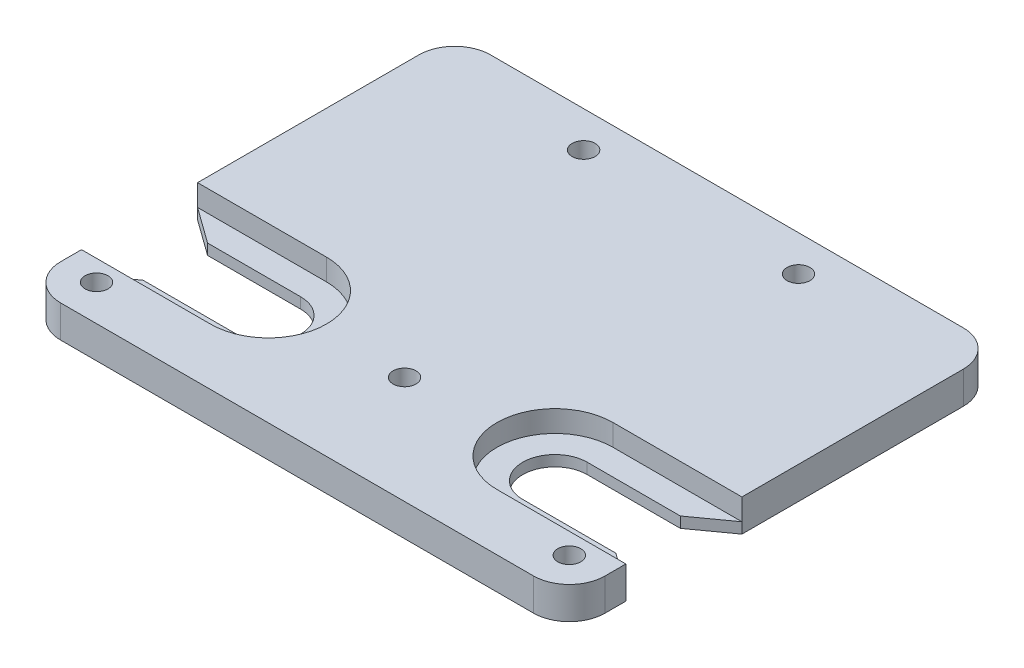
from build123d import *

# Parameters (mm, degrees)
SKETCH1_W           = 76
SKETCH1_H           = 60
BOSS_EXTRUDE1_DEPTH = 4.5
CUT_EXTRUDE1_DEPTH  = 3
CUT_EXTRUDE2_DEPTH  = 49.507731343
FILLET1_R           = 5
SKETCH4_R           = 1.6
CUT_EXTRUDE3_DEPTH  = 49.623553963


with BuildPart() as part:
    # Sketch1 → Boss-Extrude1 (new body)
    with BuildSketch(Plane(origin=(0, 0, 0), x_dir=(1, 0, 0), z_dir=(0, 1, 0))):
        Rectangle(SKETCH1_W, SKETCH1_H)
    extrude(amount=BOSS_EXTRUDE1_DEPTH)

    # Sketch2 → Cut-Extrude1 (cut)
    with BuildSketch(Plane(origin=(0, 4.5, 0), x_dir=(1, 0, 0), z_dir=(0, 1, 0))):
        with BuildLine():
            Line((20, -5.9), (38, -5.9))
            Line((38, -5.9), (38, -22.1))
            Line((38, -22.1), (20, -22.1))
            ThreePointArc((20, -22.1), (11.9, -14), (20, -5.9))
        make_face()
    cut_extrude1 = extrude(amount=-CUT_EXTRUDE1_DEPTH, mode=Mode.SUBTRACT)

    # Sketch3 → Cut-Extrude2 (cut, through all)
    with BuildSketch(Plane(origin=(0, 1.5, 0), x_dir=(1, 0, 0), z_dir=(0, 1, 0))):
        with BuildLine():
            Line((20, -9.5), (33, -9.5))
            Line((33, -9.5), (38, -5.9))
            Line((38, -5.9), (38, -22.1))
            Line((38, -22.1), (33, -18.5))
            Line((33, -18.5), (20, -18.5))
            ThreePointArc((20, -18.5), (15.5, -14), (20, -9.5))
        make_face()
    cut_extrude2 = extrude(amount=-CUT_EXTRUDE2_DEPTH, mode=Mode.SUBTRACT)

    # Mirror1: Cut-Extrude1, Cut-Extrude2 across plane
    add(cut_extrude1.mirror(Plane(origin=(0, 0, 0), x_dir=(0, 0, 1), z_dir=(1, 0, 0))), mode=Mode.SUBTRACT)
    add(cut_extrude2.mirror(Plane(origin=(0, 0, 0), x_dir=(0, 0, 1), z_dir=(1, 0, 0))), mode=Mode.SUBTRACT)

    # Fillet1
    fillet1_edges = [part.edges().sort_by_distance(p)[0] for p in [
        (38, 2.25, 30),
        (-38, 2.25, 30),
        (-38, 2.25, -30),
        (38, 2.25, -30),
    ]]
    fillet(fillet1_edges, radius=FILLET1_R)

    # Sketch4 → Cut-Extrude3 (cut, through all)
    with BuildSketch(Plane(origin=(0, 4.5, 0), x_dir=(1, 0, 0), z_dir=(0, 1, 0))):
        with Locations(Location((-15, 25, 0), (0, 0, 270))):
            Circle(SKETCH4_R)
        with Locations(Location((15, 25, 0), (0, 0, 270))):
            Circle(SKETCH4_R)
        with Locations(Location((33, -25, 0), (0, 0, 270))):
            Circle(SKETCH4_R)
        with Locations(Location((-33, -25, 0), (0, 0, 270))):
            Circle(SKETCH4_R)
        with Locations(Location((0, -15, 0), (0, 0, 270))):
            Circle(SKETCH4_R)
    extrude(amount=-CUT_EXTRUDE3_DEPTH, mode=Mode.SUBTRACT)


solid = part.part
